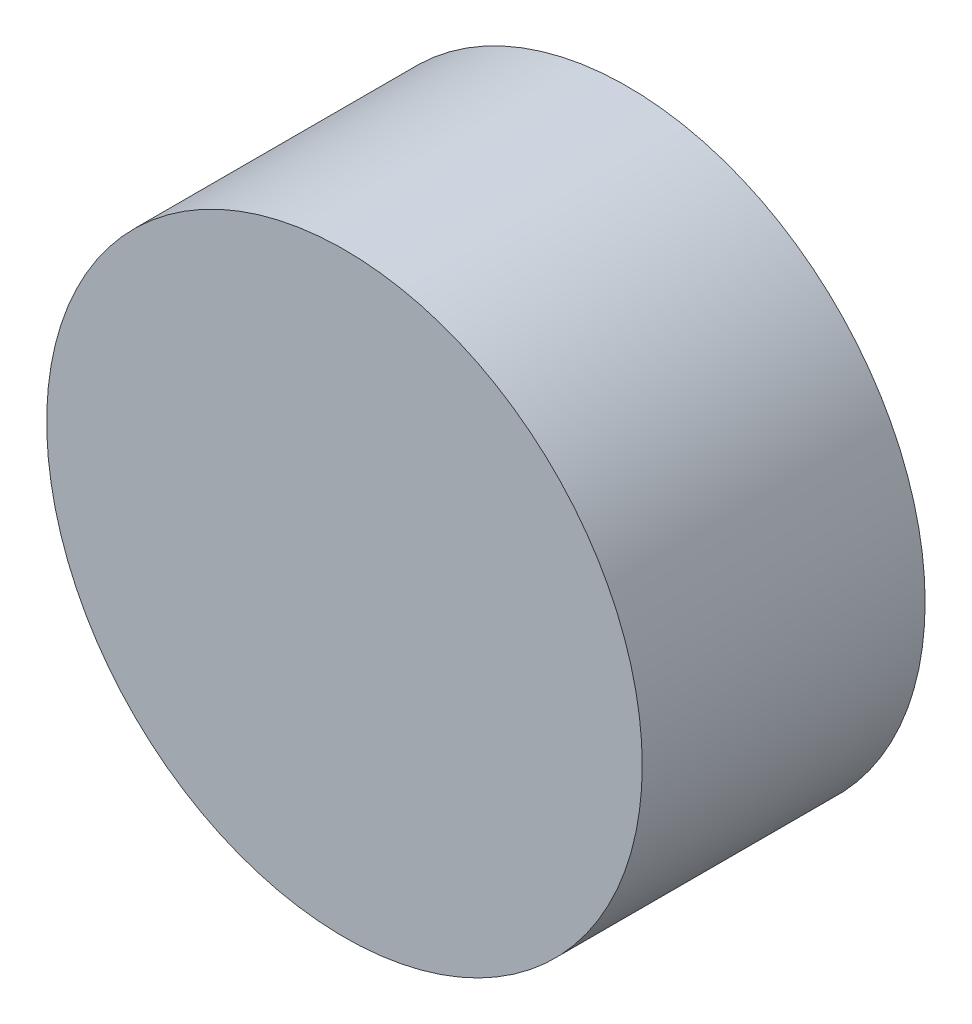
from build123d import *

# Parameters (mm, degrees)
SZKIC1_R                    = 40
DODANIE_WYCI_GNI_CIE1_DEPTH = 38


with BuildPart() as part:
    # Szkic1 → Dodanie-wyciągnięcie1 (new body)
    with BuildSketch(Plane.XY):
        Circle(SZKIC1_R)
    extrude(amount=DODANIE_WYCI_GNI_CIE1_DEPTH)


solid = part.part
